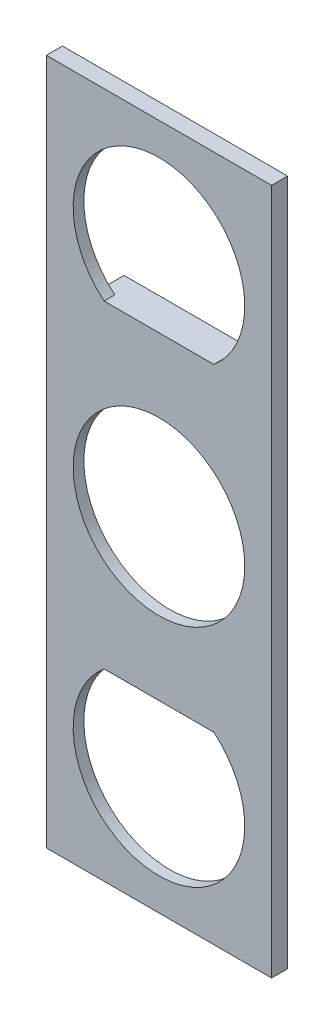
from build123d import *

# Parameters (mm, degrees)
SKETCH1_W             = 25
SKETCH1_H             = 5
BOSS_EXTRUDE1_DEPTH   = 6
BOSS_EXTRUDE1_2_DEPTH = 6
SKETCH2_W             = 42
SKETCH2_H             = 128
SKETCH2_W_2           = 34
SKETCH2_H_2           = 120
BOSS_EXTRUDE2_DEPTH   = 3
SKETCH2_3_W           = 34
SKETCH2_3_H           = 120
SKETCH2_3_R           = 16
BOSS_EXTRUDE3_DEPTH   = 2


with BuildPart() as part:
    # Sketch1 → Boss-Extrude1 (new body)
    with BuildSketch(Plane.XY):
        with Locations((0, -27.19848481)):
            Rectangle(SKETCH1_W, SKETCH1_H)
    extrude(amount=BOSS_EXTRUDE1_DEPTH)



with BuildPart() as body_2:
    # Sketch1 → Boss-Extrude1 2 (new body)
    with BuildSketch(Plane.XY):
        with Locations((0, 27.19848481)):
            Rectangle(SKETCH1_W, SKETCH1_H)
    extrude(amount=BOSS_EXTRUDE1_2_DEPTH)


with BuildPart() as body_3:
    # Sketch2 → Boss-Extrude2 (new body)
    with BuildSketch(Plane.XY.offset(6)):
        Rectangle(SKETCH2_W, SKETCH2_H)
        Rectangle(SKETCH2_W_2, SKETCH2_H_2, mode=Mode.SUBTRACT)
    extrude(amount=-BOSS_EXTRUDE2_DEPTH)


with BuildPart() as part_1:
    add(part.part)

    add(body_2.part)  # Boss-Extrude3 merges body 2

    add(body_3.part)  # Boss-Extrude3 merges body 3
    # Sketch2<3> → Boss-Extrude3 (add)
    with BuildSketch(Plane.XY.offset(6)):
        Rectangle(SKETCH2_3_W, SKETCH2_3_H)
        with BuildLine():
            ThreePointArc((10.23096887, -29.69848481), (14.486122703, -35.206455341), (16, -42))
            ThreePointArc((16, -42), (-6.793544659, -56.486122703), (-10.23096887, -29.69848481))
            Line((-10.23096887, -29.69848481), (-12.5, -29.69848481))
            Line((-12.5, -29.69848481), (-12.5, -24.69848481))
            Line((-12.5, -24.69848481), (12.5, -24.69848481))
            Line((12.5, -24.69848481), (12.5, -29.69848481))
            Line((12.5, -29.69848481), (10.23096887, -29.69848481))
        make_face(mode=Mode.SUBTRACT)
        with Locations((0, 42)):
            Circle(SKETCH2_3_R, mode=Mode.SUBTRACT)
        Circle(SKETCH2_3_R, mode=Mode.SUBTRACT)
    extrude(amount=-BOSS_EXTRUDE3_DEPTH)


solid = part_1.part
